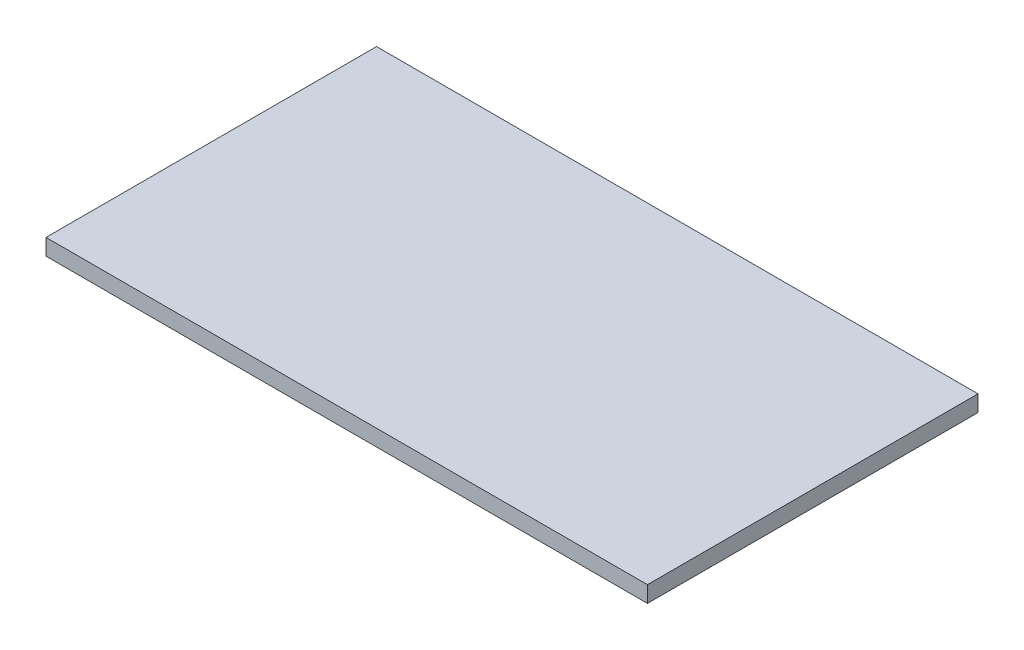
from build123d import *

# Parameters (mm, degrees)
SKETCH1_W           = 111
SKETCH1_H           = 61
BOSS_EXTRUDE1_DEPTH = 3


with BuildPart() as part:
    # Sketch1 → Boss-Extrude1 (new body)
    with BuildSketch(Plane(origin=(0, 0, 0), x_dir=(1, 0, 0), z_dir=(0, 1, 0))):
        with Locations((5.138715005, -1.994135041)):
            Rectangle(SKETCH1_W, SKETCH1_H)
    extrude(amount=BOSS_EXTRUDE1_DEPTH)


solid = part.part
